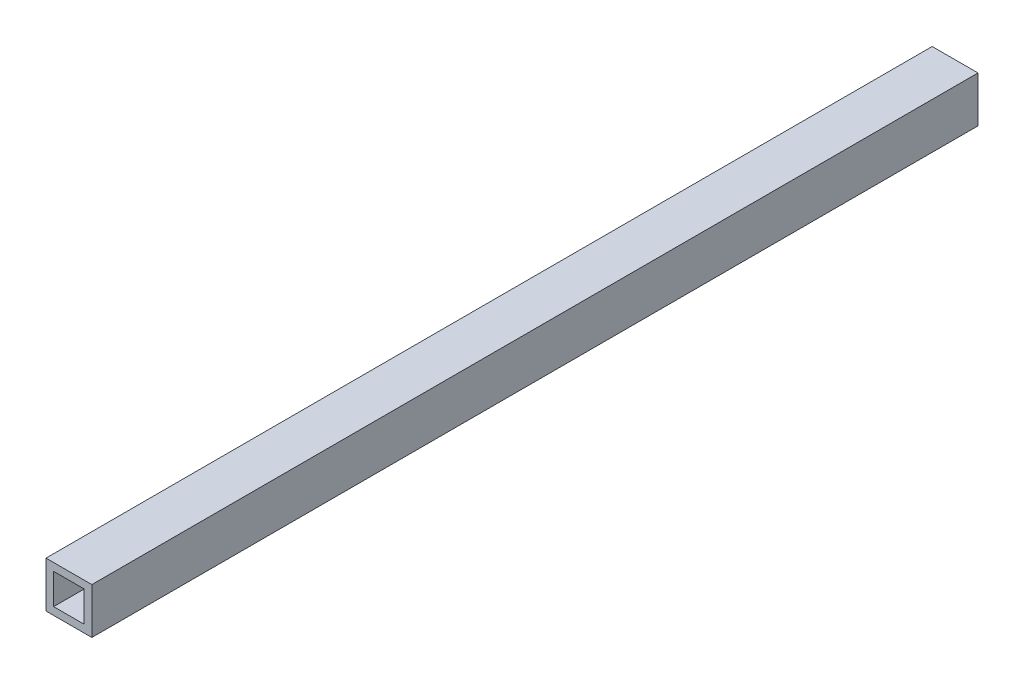
from build123d import *

# Parameters (mm, degrees)
SKETCH1_W           = 19.05
SKETCH1_H           = 19.05
SKETCH1_W_2         = 12.7
SKETCH1_H_2         = 12.7
BOSS_EXTRUDE1_DEPTH = 184.15


with BuildPart() as part:
    # Sketch1 → Boss-Extrude1 (new, symmetric)
    with BuildSketch(Plane.XY):
        Rectangle(SKETCH1_W, SKETCH1_H)
        Rectangle(SKETCH1_W_2, SKETCH1_H_2, mode=Mode.SUBTRACT)
    extrude(amount=BOSS_EXTRUDE1_DEPTH, both=True)


solid = part.part
